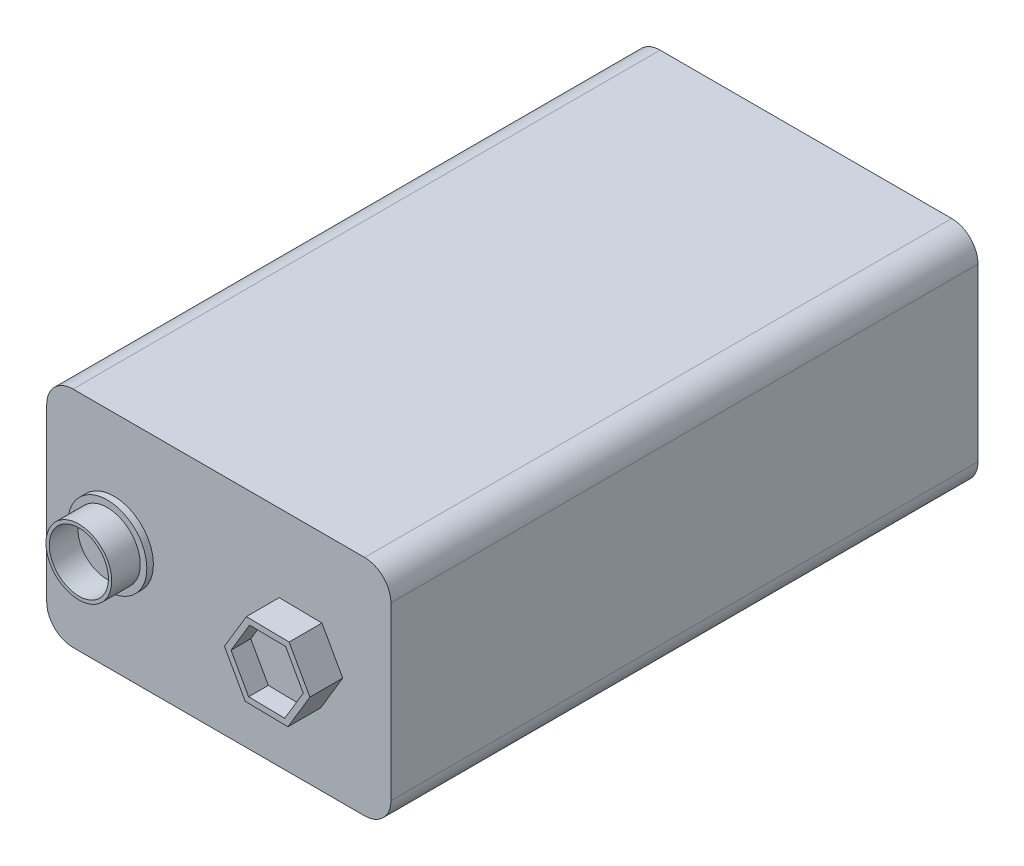
from build123d import *

# Parameters (mm, degrees)
BOSS_EXTRUDE1_DEPTH = 44.67
SKETCH5_R           = 2.5
SKETCH5_R_2         = 2.25
BOSS_EXTRUDE3_DEPTH = 2.67
BOSS_EXTRUDE4_DEPTH = 2.5
CUT_EXTRUDE1_DEPTH  = 1.5
SKETCH8_R           = 3
BOSS_EXTRUDE5_DEPTH = 0.5
CUT_EXTRUDE2_DEPTH  = 0.5


with BuildPart() as part:
    # Sketch2 → Boss-Extrude1 (new body)
    with BuildSketch(Plane.XY):
        with BuildLine():
            Line((-10.917349753, 9.379815667), (11.272650247, 9.379815667))
            ThreePointArc((11.272650247, 9.379815667), (12.686863809, 8.79402923), (13.272650247, 7.379815667))
            Line((13.272650247, 7.379815667), (13.272650247, -5.650184333))
            ThreePointArc((13.272650247, -5.650184333), (12.686863809, -7.064397895), (11.272650247, -7.650184333))
            Line((11.272650247, -7.650184333), (-10.917349753, -7.650184333))
            ThreePointArc((-10.917349753, -7.650184333), (-12.331563316, -7.064397895), (-12.917349753, -5.650184333))
            Line((-12.917349753, -5.650184333), (-12.917349753, 7.379815667))
            ThreePointArc((-12.917349753, 7.379815667), (-12.331563316, 8.79402923), (-10.917349753, 9.379815667))
        make_face()
    extrude(amount=BOSS_EXTRUDE1_DEPTH)

    # Sketch5 → Boss-Extrude3 (add)
    with BuildSketch(Plane.XY.offset(44.67)):
        with Locations(Location((-7.802350724, 0.879377713, 0), (0, 0, 180))):
            Circle(SKETCH5_R)
        with Locations(Location((-7.802350724, 0.879377713, 0), (0, 0, 180))):
            Circle(SKETCH5_R_2, mode=Mode.SUBTRACT)
    extrude(amount=BOSS_EXTRUDE3_DEPTH)

    # Sketch6 → Boss-Extrude4 (add)
    with BuildSketch(Plane.XY.offset(44.67)):
        Polygon((7.936912885, -2.196006161), (9.606104423, 0.593062405), (8.025295961, 3.433158964), (4.775295961, 3.484186957), (3.106104423, 0.695118391), (4.686912885, -2.144978168), align=None)
    extrude(amount=BOSS_EXTRUDE4_DEPTH)

    # Sketch7 → Cut-Extrude1 (cut)
    with BuildSketch(Plane.XY.offset(47.17)):
        Polygon((4.944124696, -1.715098045), (7.693231683, -1.758314137), (9.105211411, 0.600874306), (7.768084151, 3.003278841), (5.018977163, 3.046494933), (3.606997436, 0.68730649), align=None)
    extrude(amount=-CUT_EXTRUDE1_DEPTH, mode=Mode.SUBTRACT)

    # Sketch8 → Boss-Extrude5 (add)
    with BuildSketch(Plane.XY.offset(44.67)):
        with Locations((-7.802350724, 0.879377713)):
            Circle(SKETCH8_R)
    extrude(amount=BOSS_EXTRUDE5_DEPTH)

    # Sketch10 → Cut-Extrude2 (cut)
    # profile 1 of 8: a face of its own
    with BuildSketch(Plane.XZ.offset(7.650184333)):
        Polygon((3.508922568, 1.794854053), (3.508922568, 1.480751489), (0.367896927, 1.480751489), (0.367896927, 0.134597642), (0.008922568, 0.134597642), (0.008922568, 1.794854053), align=None)
    # profile 2 of 8: a face of its own
    with BuildSketch(Plane.XZ.offset(7.650184333)):
        Polygon((3.517845136, 4.038426054), (3.517845136, 3.72432349), (0.376819495, 3.72432349), (0.376819495, 2.378169644), (0.017845136, 2.378169644), (0.017845136, 4.038426054), align=None)
    # profile 3 of 8: a face of its own
    with BuildSketch(Plane.XZ.offset(7.650184333)):
        Polygon((3.528195315, 6.640969576), (3.528195315, 4.666610601), (3.169220956, 4.666610601), (3.169220956, 6.326867011), (2.092297879, 6.326867011), (2.092297879, 4.666610601), (1.73332352, 4.666610601), (1.73332352, 6.326867011), (0.387169674, 6.326867011), (0.387169674, 4.666610601), (0.028195315, 4.666610601), (0.028195315, 6.640969576), align=None)
    # profile 4 of 8: a face of its own
    with BuildSketch(Plane.XZ.offset(7.650184333)):
        with BuildLine():
            Line((2.901671471, 7.358887067), (2.691334933, 7.633726811))
            add(Edge.make_bspline(
                [(2.691334933, 7.633726811), (2.714700903, 7.653332699), (2.761117818, 7.692280146), (2.826297363, 7.754939349), (2.887362624, 7.820240991), (2.944604504, 7.888160113), (2.99602127, 7.959919232), (3.044292373, 8.033780031), (3.08756011, 8.110978076), (3.140023097, 8.217729811), (3.194769252, 8.357377659), (3.240672483, 8.533172498), (3.269893659, 8.716683596), (3.2730585, 8.841881196), (3.274668266, 8.905561747)],
                knots=[0, 0, 0, 0, 0.757959112, 1.505699292, 2.245454638, 2.979532153, 3.711538275, 4.438200793, 5.171680507, 5.909471876, 7.393775596, 8.890124382, 10.418191784, 12, 12, 12, 12], degree=3))
            add(Edge.make_bspline(
                [(3.274668266, 8.905561747), (3.274262481, 8.94064462), (3.273454676, 9.010484763), (3.262872451, 9.11413953), (3.247827715, 9.216055063), (3.226047336, 9.315852374), (3.197691257, 9.413333312), (3.164437147, 9.509240112), (3.123055781, 9.602443248), (3.077355587, 9.694064397), (3.025722766, 9.781839555), (2.969422502, 9.864907532), (2.909007374, 9.94288883), (2.84463333, 10.015999537), (2.77550033, 10.083437835), (2.702421644, 10.146284525), (2.624517677, 10.20340696), (2.543249454, 10.256208826), (2.458497525, 10.303193042), (2.370795051, 10.343766188), (2.280477351, 10.378540747), (2.187359402, 10.406312098), (2.091807647, 10.428217097), (1.993619303, 10.443350066), (1.892984958, 10.453837095), (1.824775736, 10.454637468), (1.790393426, 10.455040913)],
                knots=[0, 0, 0, 0, 1.055000685, 2.100209969, 3.131349012, 4.153242145, 5.170189196, 6.184191144, 7.204341339, 8.235672124, 9.263040994, 10.265373269, 11.252624173, 12.22887325, 13.193405896, 14.155809299, 15.126090485, 16.097288279, 17.069732292, 18.038585918, 19.002221264, 19.978698174, 20.959418239, 21.948869816, 22.966084182, 24, 24, 24, 24], degree=3))
            add(Edge.make_bspline(
                [(1.790393426, 10.455040913), (1.738662106, 10.453779094), (1.637094522, 10.45130168), (1.488323911, 10.429253346), (1.345803237, 10.395748255), (1.210423395, 10.345532678), (1.080515037, 10.283613627), (0.958276183, 10.205373016), (0.841859619, 10.114756478), (0.734016671, 10.010482059), (0.635502946, 9.896076243), (0.548752364, 9.773328331), (0.476437482, 9.642544044), (0.416261535, 9.505167413), (0.370004808, 9.360141299), (0.337440684, 9.207726497), (0.316198504, 9.048254502), (0.314164816, 8.939285102), (0.313129805, 8.883826971)],
                knots=[0, 0, 0, 0, 1.029171465, 2.020641659, 2.987623507, 3.938342917, 4.889210282, 5.84687017, 6.821220943, 7.821438502, 8.827599549, 9.822697543, 10.807740252, 11.797342354, 12.80366471, 13.83203677, 14.896651826, 16, 16, 16, 16], degree=3))
            add(Edge.make_bspline(
                [(0.313129805, 8.883826971), (0.314818584, 8.822724282), (0.318142507, 8.702459573), (0.346301756, 8.526091547), (0.391959674, 8.357255781), (0.455857596, 8.195943195), (0.538922884, 8.042608548), (0.639620761, 7.897011888), (0.758909094, 7.759030318), (0.849992222, 7.676059035), (0.896463138, 7.633726811)],
                knots=[0, 0, 0, 0, 1.028121516, 2.023589091, 2.998037872, 3.967518031, 4.937445131, 5.927275754, 6.942489185, 8, 8, 8, 8], degree=3))
            Line((0.896463138, 7.633726811), (0.688229965, 7.358887067))
            add(Edge.make_bspline(
                [(0.688229965, 7.358887067), (0.659691464, 7.381005148), (0.60275116, 7.425135364), (0.522480174, 7.496593817), (0.446973436, 7.571869488), (0.376855871, 7.65153125), (0.310663701, 7.734626349), (0.250615968, 7.822618463), (0.194883519, 7.913987797), (0.144527085, 8.009266317), (0.099377015, 8.108141211), (0.061260078, 8.210509582), (0.027952984, 8.315504159), (0.000732765, 8.423177818), (-0.020546953, 8.533890267), (-0.034764257, 8.647261649), (-0.044506812, 8.763531279), (-0.04539464, 8.841972734), (-0.045844554, 8.881723606)],
                knots=[0, 0, 0, 0, 0.986756325, 1.968786143, 2.935506311, 3.899499537, 4.868307269, 5.8376204, 6.809456583, 7.792545619, 8.781780509, 9.778496008, 10.776623214, 11.79151764, 12.812666265, 13.856269958, 14.913646641, 16, 16, 16, 16], degree=3))
            add(Edge.make_bspline(
                [(-0.045844554, 8.881723606), (-0.045582562, 8.919367273), (-0.045064504, 8.993802963), (-0.036672337, 9.103701714), (-0.0252226, 9.210691295), (-0.007982469, 9.314465921), (0.012361871, 9.415591896), (0.039633128, 9.513152481), (0.070182295, 9.608107691), (0.106087281, 9.700076032), (0.146603464, 9.789135732), (0.192395023, 9.874999543), (0.243076887, 9.957627975), (0.297531898, 10.037833396), (0.3575092, 10.11443098), (0.422175834, 10.188084505), (0.491313845, 10.259206981), (0.541168698, 10.303209666), (0.566234772, 10.325333381)],
                knots=[0, 0, 0, 0, 1.114604814, 2.203992996, 3.262667896, 4.300477797, 5.318619304, 6.316056647, 7.298880507, 8.271930387, 9.238335007, 10.195173496, 11.151986948, 12.108099108, 13.064862484, 14.031167946, 15.010108607, 16, 16, 16, 16], degree=3))
            add(Edge.make_bspline(
                [(0.566234772, 10.325333381), (0.609775961, 10.360769025), (0.696332672, 10.431212502), (0.836618653, 10.521338185), (0.983086862, 10.59848574), (1.136506791, 10.660861661), (1.296534178, 10.709624394), (1.463249692, 10.743405589), (1.636497635, 10.765357194), (1.754334423, 10.767867483), (1.814231567, 10.769143477)],
                knots=[0, 0, 0, 0, 0.994628077, 1.977248131, 2.950237994, 3.925870899, 4.908910175, 5.911660606, 6.938484602, 8, 8, 8, 8], degree=3))
            add(Edge.make_bspline(
                [(1.814231567, 10.769143477), (1.877184387, 10.767581328), (2.001040129, 10.764507896), (2.182851676, 10.738611381), (2.356789343, 10.696446851), (2.523522403, 10.638386013), (2.68209687, 10.561788243), (2.833182473, 10.469060448), (2.976655845, 10.359296902), (3.110682667, 10.233876129), (3.233218755, 10.096301546), (3.341025812, 9.948984627), (3.430743103, 9.792202181), (3.505739326, 9.627684463), (3.563383773, 9.454198745), (3.603736964, 9.272115386), (3.628854079, 9.081776469), (3.632029287, 8.951914043), (3.633642625, 8.885930336)],
                knots=[0, 0, 0, 0, 1.032901378, 2.032168977, 3.007206631, 3.966850309, 4.924221947, 5.891988639, 6.871730993, 7.884084801, 8.900290346, 9.89161143, 10.874607481, 11.860025555, 12.854717796, 13.869097222, 14.917278314, 16, 16, 16, 16], degree=3))
            add(Edge.make_bspline(
                [(3.633642625, 8.885930336), (3.633160847, 8.845715786), (3.632207216, 8.766115132), (3.622895852, 8.648363622), (3.607401446, 8.533717096), (3.586173063, 8.421898298), (3.560154181, 8.312501749), (3.526093454, 8.206649777), (3.4865406, 8.103765977), (3.442148195, 8.003773296), (3.391397504, 7.907759624), (3.336276934, 7.815742433), (3.275514118, 7.728831743), (3.211117876, 7.645392759), (3.140679366, 7.567303954), (3.066492472, 7.492335134), (2.986355811, 7.423076002), (2.929951258, 7.380322546), (2.901671471, 7.358887067)],
                knots=[0, 0, 0, 0, 1.096705196, 2.170817488, 3.219277236, 4.250701065, 5.274195539, 6.284202015, 7.28098643, 8.279664616, 9.266225751, 10.241373748, 11.203306326, 12.157093976, 13.114198862, 14.069774147, 15.032234603, 16, 16, 16, 16], degree=3))
        make_face()
    # profile 5 of 8: a face of its own
    with BuildSketch(Plane.XZ.offset(7.650184333)):
        Polygon((3.558175144, 12.743474064), (0.058175144, 11.128089449), (0.058175144, 11.469535763), (1.179970016, 11.986963648), (1.179970016, 13.573602269), (0.058175144, 14.10505259), (0.058175144, 14.448602269), (3.558175144, 12.788345859), align=None)
        Polygon((2.875282516, 12.769415571), (1.538944375, 13.402528551), (1.538944375, 12.152428391), align=None, mode=Mode.SUBTRACT)
    # profile 6 of 8: a face of its own
    with BuildSketch(Plane.XZ.offset(7.650184333)):
        with BuildLine():
            Line((3.569952934, 17.140886542), (3.569952934, 16.440465869))
            add(Edge.make_bspline(
                [(3.569952934, 16.440465869), (3.569797348, 16.39372474), (3.569498606, 16.303976596), (3.567832843, 16.175403326), (3.563058487, 16.058576229), (3.558949904, 15.953556389), (3.551457963, 15.860345734), (3.544297315, 15.778658444), (3.534923655, 15.708870746), (3.526218232, 15.666624895), (3.522276652, 15.647497119)],
                knots=[0, 0, 0, 0, 1.410062039, 2.707475311, 3.878576406, 4.937260626, 5.877586885, 6.699081471, 7.410979367, 8, 8, 8, 8], degree=3))
            add(Edge.make_bspline(
                [(3.522276652, 15.647497119), (3.515950605, 15.621890044), (3.503433461, 15.571222162), (3.476963448, 15.498278639), (3.446382239, 15.428740174), (3.410184681, 15.362867723), (3.369002137, 15.300655176), (3.322593992, 15.242195682), (3.270723908, 15.187823471), (3.214716429, 15.137120174), (3.154082871, 15.091159268), (3.089706502, 15.051386117), (3.021989958, 15.017328567), (2.950697425, 14.990139401), (2.876431564, 14.96826655), (2.798543895, 14.952838898), (2.717382608, 14.943588101), (2.662024742, 14.942646192), (2.633955338, 14.942168593)],
                knots=[0, 0, 0, 0, 1.02737288, 2.032829108, 3.019628684, 3.985738875, 4.958353778, 5.924249254, 6.890702889, 7.883913451, 8.865824512, 9.85161466, 10.829249435, 11.81541824, 12.821369441, 13.843154991, 14.906364023, 16, 16, 16, 16], degree=3))
            add(Edge.make_bspline(
                [(2.633955338, 14.942168593), (2.58732018, 14.943637553), (2.496322907, 14.946503875), (2.364262775, 14.973229511), (2.24107072, 15.017004083), (2.126918181, 15.077334547), (2.02397016, 15.154127471), (1.933853388, 15.246415103), (1.857745669, 15.353726136), (1.805529065, 15.454094691), (1.771930664, 15.542797075), (1.748172032, 15.616036745), (1.730125055, 15.695989509), (1.713722875, 15.781508323), (1.701206694, 15.873253744), (1.692317826, 15.971041018), (1.686602217, 16.075114716), (1.685767142, 16.146454478), (1.68533755, 16.18315417)],
                knots=[0, 0, 0, 0, 1.260402266, 2.459371274, 3.627181936, 4.786749125, 5.93865593, 7.087644312, 8.261344208, 9.485713728, 10.136162886, 10.825977872, 11.566646758, 12.35154167, 13.181268117, 14.0701832, 15.007234106, 16, 16, 16, 16], degree=3))
            Line((1.68533755, 16.18315417), (0.069952934, 14.897296798))
            Line((0.069952934, 14.897296798), (0.069952934, 15.285718273))
            Line((0.069952934, 15.285718273), (1.68533755, 16.571575645))
            Line((1.68533755, 16.571575645), (1.68533755, 16.826783978))
            Line((1.68533755, 16.826783978), (0.069952934, 16.826783978))
            Line((0.069952934, 16.826783978), (0.069952934, 17.140886542))
            Line((0.069952934, 17.140886542), (3.569952934, 17.140886542))
        make_face()
        with BuildLine():
            Line((3.210978575, 16.826783978), (2.044311909, 16.826783978))
            Line((2.044311909, 16.826783978), (2.039404056, 16.185958657))
            add(Edge.make_bspline(
                [(2.039404056, 16.185958657), (2.03939082, 16.156038619), (2.039365163, 16.098045062), (2.043358938, 16.014144395), (2.047902261, 15.936024289), (2.054851592, 15.863983518), (2.063807712, 15.797990005), (2.075010538, 15.738076387), (2.088063115, 15.684146003), (2.108262577, 15.621244652), (2.140283216, 15.551027136), (2.18679137, 15.474621093), (2.245666995, 15.40977592), (2.311920361, 15.353866812), (2.386262747, 15.310802559), (2.465394377, 15.279459339), (2.548632081, 15.259789722), (2.605803925, 15.257451282), (2.63465646, 15.256271157)],
                knots=[0, 0, 0, 0, 1.14660753, 2.222451964, 3.218720504, 4.145691244, 4.995719623, 5.770487122, 6.480909919, 7.121111896, 8.299844659, 9.430703709, 10.534634535, 11.641396424, 12.741395289, 13.810956493, 14.895269934, 16, 16, 16, 16], degree=3))
            add(Edge.make_bspline(
                [(2.63465646, 15.256271157), (2.662810839, 15.25745491), (2.718602545, 15.259800675), (2.800055982, 15.27949745), (2.877482843, 15.311304861), (2.949407322, 15.355906213), (3.015239314, 15.409800106), (3.070788231, 15.473807118), (3.117307212, 15.544703777), (3.146817355, 15.611013999), (3.164945905, 15.670242155), (3.177687069, 15.721674262), (3.188009918, 15.780009032), (3.196035737, 15.845106664), (3.203258058, 15.916849384), (3.207940819, 15.99543364), (3.210771081, 16.080768683), (3.210907801, 16.139915865), (3.210978575, 16.170533978)],
                knots=[0, 0, 0, 0, 1.100801541, 2.181386982, 3.260112282, 4.364594493, 5.481957178, 6.577424609, 7.668452592, 8.790448866, 9.403819393, 10.091598921, 10.863153553, 11.720938239, 12.658472417, 13.685008818, 14.801622349, 16, 16, 16, 16], degree=3))
            Line((3.210978575, 16.170533978), (3.210978575, 16.826783978))
        make_face(mode=Mode.SUBTRACT)
    # profile 7 of 8: a face of its own
    with BuildSketch(Plane.XZ.offset(7.650184333)):
        with BuildLine():
            Line((3.582622981, 20.326758784), (3.582622981, 20.01265622))
            Line((3.582622981, 20.01265622), (1.485567693, 20.01265622))
            add(Edge.make_bspline(
                [(1.485567693, 20.01265622), (1.455886957, 20.012702964), (1.399562646, 20.012791669), (1.319394345, 20.012199155), (1.248121886, 20.010539786), (1.185470539, 20.009493627), (1.131727791, 20.007166293), (1.086602481, 20.005268246), (1.050308278, 20.00282769), (1.029127352, 19.999894572), (1.020022821, 19.998633784)],
                knots=[0, 0, 0, 0, 1.528628734, 2.90083645, 4.128790002, 5.200304208, 6.127813768, 6.898992206, 7.526736466, 8, 8, 8, 8], degree=3))
            add(Edge.make_bspline(
                [(1.020022821, 19.998633784), (0.987173213, 19.993461351), (0.923324954, 19.983407932), (0.832455591, 19.957692801), (0.750279481, 19.922068584), (0.675157723, 19.878694116), (0.60820714, 19.822913517), (0.546049846, 19.756523513), (0.492350342, 19.675337136), (0.442947065, 19.585121682), (0.403296604, 19.487823862), (0.373299446, 19.38841586), (0.35502151, 19.288372051), (0.352904845, 19.221395994), (0.35185375, 19.188136989)],
                knots=[0, 0, 0, 0, 1.035924841, 2.013479024, 2.933602255, 3.82183108, 4.706948133, 5.639927629, 6.646101806, 7.731477349, 8.84205456, 9.913728764, 10.963998332, 12, 12, 12, 12], degree=3))
            add(Edge.make_bspline(
                [(0.35185375, 19.188136989), (0.352927541, 19.159583197), (0.355068921, 19.102640532), (0.368331236, 19.018034872), (0.392228427, 18.935631819), (0.423080991, 18.855042314), (0.463781149, 18.779449934), (0.511122162, 18.708908778), (0.565841509, 18.645277383), (0.627261619, 18.587893767), (0.695929258, 18.537651722), (0.771637533, 18.49526043), (0.854137567, 18.459532696), (0.912311955, 18.442023791), (0.942198302, 18.433028816)],
                knots=[0, 0, 0, 0, 0.994510594, 1.983277156, 2.972612928, 3.9776239, 4.982470102, 5.955333794, 6.930747147, 7.898149105, 8.876444039, 9.885893618, 10.913904934, 12, 12, 12, 12], degree=3))
            add(Edge.make_bspline(
                [(0.942198302, 18.433028816), (0.954546876, 18.430028691), (0.982064476, 18.423343202), (1.028585767, 18.417096158), (1.083475131, 18.410589632), (1.147126943, 18.406075062), (1.219327916, 18.401673842), (1.300454173, 18.399040769), (1.390211134, 18.397823736), (1.452848296, 18.397461056), (1.485567693, 18.397271604)],
                knots=[0, 0, 0, 0, 0.558680831, 1.244966039, 2.062412453, 2.990489873, 4.051219941, 5.244515665, 6.560634259, 8, 8, 8, 8], degree=3))
            Line((1.485567693, 18.397271604), (3.582622981, 18.397271604))
            Line((3.582622981, 18.397271604), (3.582622981, 18.08316904))
            Line((3.582622981, 18.08316904), (1.46874077, 18.08316904))
            add(Edge.make_bspline(
                [(1.46874077, 18.08316904), (1.430641981, 18.083420353), (1.356289878, 18.083910806), (1.247344213, 18.088250383), (1.143971115, 18.094969604), (1.04630248, 18.10512761), (0.954222001, 18.116341683), (0.867864204, 18.132386752), (0.786650042, 18.149160077), (0.710718563, 18.170376404), (0.639065117, 18.195970291), (0.569799784, 18.225935882), (0.503488782, 18.26260304), (0.439174407, 18.304445281), (0.376768549, 18.350901598), (0.317736752, 18.404448177), (0.260143657, 18.462312742), (0.205889744, 18.525714188), (0.155780501, 18.593519461), (0.112676529, 18.665849004), (0.074828774, 18.741246388), (0.044932705, 18.820519181), (0.02179302, 18.903151045), (0.004763839, 18.989137708), (-0.004951132, 19.07877158), (-0.006391319, 19.139736968), (-0.007120609, 19.170608944)],
                knots=[0, 0, 0, 0, 1.316364231, 2.568964831, 3.766826305, 4.894964518, 5.961692026, 6.970710131, 7.928946231, 8.826316495, 9.692177228, 10.556379512, 11.43093279, 12.306715499, 13.20629939, 14.115652445, 15.057829886, 16.025681089, 16.996391533, 17.967202739, 18.931442607, 19.907779629, 20.889445314, 21.893507297, 22.933303057, 24, 24, 24, 24], degree=3))
            add(Edge.make_bspline(
                [(-0.007120609, 19.170608944), (-0.006335843, 19.204278047), (-0.004796137, 19.270336706), (0.004026613, 19.367674773), (0.020645008, 19.460988969), (0.041804951, 19.551264846), (0.070988689, 19.637273343), (0.105086814, 19.720166788), (0.146964074, 19.798525469), (0.193557467, 19.873620598), (0.245982105, 19.943445354), (0.303122279, 20.007542757), (0.364062656, 20.066018627), (0.429463022, 20.117887324), (0.498814729, 20.164008208), (0.572313969, 20.203738422), (0.649932285, 20.237851666), (0.703885486, 20.255458233), (0.731160641, 20.264358944)],
                knots=[0, 0, 0, 0, 1.13879206, 2.234305948, 3.301075583, 4.341971843, 5.366689343, 6.369221514, 7.369726634, 8.367512178, 9.355451585, 10.318319045, 11.268648973, 12.207971039, 13.137398894, 14.081662264, 15.030215811, 16, 16, 16, 16], degree=3))
            add(Edge.make_bspline(
                [(0.731160641, 20.264358944), (0.749793216, 20.269536102), (0.790207685, 20.280765474), (0.857094173, 20.292790771), (0.934109091, 20.302899853), (1.021257709, 20.312405411), (1.118607576, 20.318014369), (1.226116492, 20.322931808), (1.343914453, 20.326793427), (1.425968969, 20.326770654), (1.46874077, 20.326758784)],
                knots=[0, 0, 0, 0, 0.625038921, 1.35572334, 2.194682327, 3.136881307, 4.189498639, 5.346923369, 6.617055217, 8, 8, 8, 8], degree=3))
            Line((1.46874077, 20.326758784), (3.582622981, 20.326758784))
        make_face()
    # profile 8 of 8: a face of its own
    with BuildSketch(Plane.XZ.offset(7.650184333)):
        with BuildLine():
            Line((0.09689909, 23.916473986), (3.59689909, 23.916473986))
            Line((3.59689909, 23.916473986), (3.59689909, 23.209743217))
            add(Edge.make_bspline(
                [(3.59689909, 23.209743217), (3.596457726, 23.148274101), (3.595605013, 23.029516089), (3.590167468, 22.857905353), (3.580645568, 22.699348061), (3.566508255, 22.553934257), (3.549539519, 22.42143032), (3.527959523, 22.302048471), (3.502579986, 22.195595243), (3.480933517, 22.13012593), (3.470697167, 22.099166294)],
                knots=[0, 0, 0, 0, 1.314317071, 2.539253741, 3.67075822, 4.709970291, 5.662644612, 6.526156501, 7.303037452, 8, 8, 8, 8], degree=3))
            add(Edge.make_bspline(
                [(3.470697167, 22.099166294), (3.455266444, 22.05867158), (3.424754916, 21.978600439), (3.367198866, 21.864592943), (3.301984828, 21.757268969), (3.229032417, 21.656044705), (3.146255185, 21.563262983), (3.057246576, 21.475183205), (2.958369451, 21.395759343), (2.852980985, 21.321804072), (2.740012059, 21.257092001), (2.621755428, 21.200023471), (2.498432364, 21.15129691), (2.369145257, 21.113276774), (2.235135253, 21.081865665), (2.095387902, 21.060789559), (1.950717893, 21.046789555), (1.852542166, 21.045389496), (1.802728417, 21.044679114)],
                knots=[0, 0, 0, 0, 0.98467389, 1.947018643, 2.898343565, 3.837828625, 4.779009928, 5.722093987, 6.681368302, 7.658573986, 8.646467994, 9.637429229, 10.641859304, 11.657149908, 12.698561448, 13.768651538, 14.867827761, 16, 16, 16, 16], degree=3))
            add(Edge.make_bspline(
                [(1.802728417, 21.044679114), (1.759467325, 21.045308506), (1.674216824, 21.046548787), (1.548573834, 21.057672036), (1.426667915, 21.073870526), (1.309034464, 21.098834325), (1.194881049, 21.129508815), (1.08474977, 21.167370595), (0.978559901, 21.212240469), (0.877176436, 21.264298535), (0.780767093, 21.321221719), (0.690990908, 21.38363466), (0.606140456, 21.447955892), (0.530042935, 21.519144995), (0.458346076, 21.592296248), (0.394923791, 21.671288721), (0.337013456, 21.753548887), (0.285037773, 21.840661204), (0.239943112, 21.934713623), (0.201311316, 22.036989835), (0.169501911, 22.1480376), (0.14292014, 22.267686709), (0.121846029, 22.396171609), (0.107718702, 22.533610158), (0.098166037, 22.679793567), (0.097329606, 22.780172816), (0.09689909, 22.831838569)],
                knots=[0, 0, 0, 0, 1.105818345, 2.179130549, 3.222742436, 4.24813173, 5.251184997, 6.243232575, 7.223185975, 8.195898781, 9.155064964, 10.083206407, 10.990357329, 11.874224667, 12.744762365, 13.607037788, 14.46074101, 15.315384698, 16.197310979, 17.123950979, 18.107232398, 19.148086642, 20.256146639, 21.433991621, 22.679261309, 24, 24, 24, 24], degree=3))
            Line((0.09689909, 22.831838569), (0.09689909, 23.916473986))
        make_face()
        with BuildLine():
            Line((0.455873449, 23.602371422), (0.455873449, 23.200628634))
            add(Edge.make_bspline(
                [(0.455873449, 23.200628634), (0.456121545, 23.142900263), (0.456598726, 23.031867464), (0.460785929, 22.872209467), (0.467627866, 22.726330071), (0.477202944, 22.594208561), (0.489871559, 22.475919537), (0.503996462, 22.371215787), (0.521593913, 22.280440529), (0.537544872, 22.225511092), (0.544915917, 22.200127832)],
                knots=[0, 0, 0, 0, 1.375205317, 2.645023457, 3.804390687, 4.853969522, 5.800190428, 6.637939096, 7.370582563, 8, 8, 8, 8], degree=3))
            add(Edge.make_bspline(
                [(0.544915917, 22.200127832), (0.556166637, 22.168178795), (0.578399353, 22.105043821), (0.618969139, 22.014172505), (0.666966473, 21.929379459), (0.720633661, 21.849250042), (0.780801854, 21.774303121), (0.847653161, 21.704871177), (0.920448262, 21.640460732), (0.99945985, 21.581776373), (1.084177099, 21.529338808), (1.173521485, 21.48363366), (1.267277377, 21.444853515), (1.365782696, 21.413319655), (1.468944589, 21.388882726), (1.576491661, 21.371496139), (1.68845746, 21.360687444), (1.764609235, 21.35942516), (1.803429539, 21.358781678)],
                knots=[0, 0, 0, 0, 0.998463025, 1.973077781, 2.929496817, 3.867873318, 4.813809365, 5.759268434, 6.706333209, 7.676553387, 8.657505312, 9.640584699, 10.632319813, 11.645628493, 12.686877747, 13.755137172, 14.855624085, 16, 16, 16, 16], degree=3))
            add(Edge.make_bspline(
                [(1.803429539, 21.358781678), (1.844362774, 21.359295513), (1.924776477, 21.360304945), (2.042770647, 21.3729715), (2.156238708, 21.391521157), (2.265262353, 21.418203391), (2.36969974, 21.452674537), (2.470140894, 21.493922058), (2.565293235, 21.544003022), (2.655962666, 21.600699968), (2.740776055, 21.664352674), (2.818739769, 21.734678779), (2.889999036, 21.810936736), (2.954667312, 21.892775097), (3.01159456, 21.981338099), (3.062236152, 22.075127083), (3.10526426, 22.175463192), (3.128141444, 22.245277202), (3.13976768, 22.280756839)],
                knots=[0, 0, 0, 0, 1.122272916, 2.204715076, 3.251197285, 4.274229216, 5.279697671, 6.265416158, 7.248880903, 8.225321784, 9.195852973, 10.153576302, 11.101466393, 12.055578741, 13.010401466, 13.985536859, 14.976245305, 16, 16, 16, 16], degree=3))
            add(Edge.make_bspline(
                [(3.13976768, 22.280756839), (3.147884108, 22.310107985), (3.16514186, 22.372516575), (3.183967233, 22.474356039), (3.200571732, 22.588971189), (3.214629771, 22.71687089), (3.224717093, 22.857909349), (3.232288407, 23.012195037), (3.23739504, 23.179794642), (3.237743747, 23.295977175), (3.237924731, 23.356277672)],
                knots=[0, 0, 0, 0, 0.674548936, 1.434276114, 2.292660221, 3.240891867, 4.284742987, 5.42552168, 6.663806718, 8, 8, 8, 8], degree=3))
            Line((3.237924731, 23.356277672), (3.237924731, 23.602371422))
            Line((3.237924731, 23.602371422), (0.455873449, 23.602371422))
        make_face(mode=Mode.SUBTRACT)
    extrude(amount=-CUT_EXTRUDE2_DEPTH, mode=Mode.SUBTRACT)


solid = part.part
